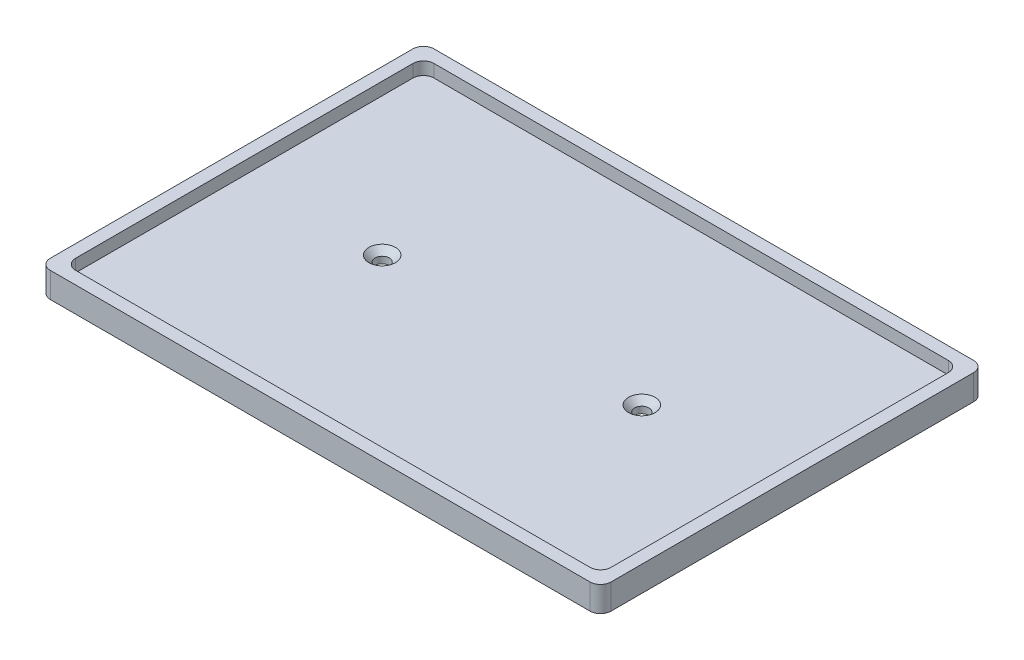
from build123d import *

# Parameters (mm, degrees)
SKETCH1_W                                       = 133
SKETCH1_H                                       = 91
BOSS_EXTRUDE1_DEPTH                             = 6
SKETCH2_W                                       = 127
SKETCH2_H                                       = 85
CUT_EXTRUDE1_DEPTH                              = 3
FILLET1_R                                       = 2.5
CSK_FOR_M3_FLAT_HEAD_MACHINE_SCREW1_D           = 3.4
CSK_FOR_M3_FLAT_HEAD_MACHINE_SCREW1_DEPTH       = 17.38
CSK_FOR_M3_FLAT_HEAD_MACHINE_SCREW1_CSINK_D     = 6.3
CSK_FOR_M3_FLAT_HEAD_MACHINE_SCREW1_CSINK_ANGLE = 90
CSK_FOR_M3_FLAT_HEAD_MACHINE_SCREW1_TIP         = 1.021463052


with BuildPart() as part:
    # Sketch1 → Boss-Extrude1 (new body)
    with BuildSketch(Plane(origin=(0, 0, 0), x_dir=(1, 0, 0), z_dir=(0, 1, 0))):
        Rectangle(SKETCH1_W, SKETCH1_H)
    extrude(amount=BOSS_EXTRUDE1_DEPTH)

    # Sketch2 → Cut-Extrude1 (cut)
    with BuildSketch(Plane(origin=(0, 6, 0), x_dir=(1, 0, 0), z_dir=(0, 1, 0))):
        Rectangle(SKETCH2_W, SKETCH2_H)
    extrude(amount=-CUT_EXTRUDE1_DEPTH, mode=Mode.SUBTRACT)

    # Fillet1
    fillet1_edges = [part.edges().sort_by_distance(p)[0] for p in [
        (63.5, 4.5, -42.5),
        (63.5, 4.5, 42.5),
        (-63.5, 4.5, 42.5),
        (-63.5, 4.5, -42.5),
        (66.5, 3, 45.5),
        (-66.5, 3, 45.5),
        (-66.5, 3, -45.5),
        (66.5, 3, -45.5),
    ]]
    fillet(fillet1_edges, radius=FILLET1_R)

    # CSK for M3 Flat Head Machine Screw1
    with Locations(Plane(origin=(0, 3, 0), x_dir=(1, 0, 0), z_dir=(0, 1, 0))):
        with Locations((-30.8, 0), (30.8, 0)):
            CounterSinkHole(CSK_FOR_M3_FLAT_HEAD_MACHINE_SCREW1_D / 2, CSK_FOR_M3_FLAT_HEAD_MACHINE_SCREW1_CSINK_D / 2, depth=CSK_FOR_M3_FLAT_HEAD_MACHINE_SCREW1_DEPTH, counter_sink_angle=CSK_FOR_M3_FLAT_HEAD_MACHINE_SCREW1_CSINK_ANGLE)
            with Locations((0, 0, -(CSK_FOR_M3_FLAT_HEAD_MACHINE_SCREW1_DEPTH + CSK_FOR_M3_FLAT_HEAD_MACHINE_SCREW1_TIP / 2))):  # 118° drill point
                Cone(0, CSK_FOR_M3_FLAT_HEAD_MACHINE_SCREW1_D / 2, CSK_FOR_M3_FLAT_HEAD_MACHINE_SCREW1_TIP, mode=Mode.SUBTRACT)


solid = part.part
